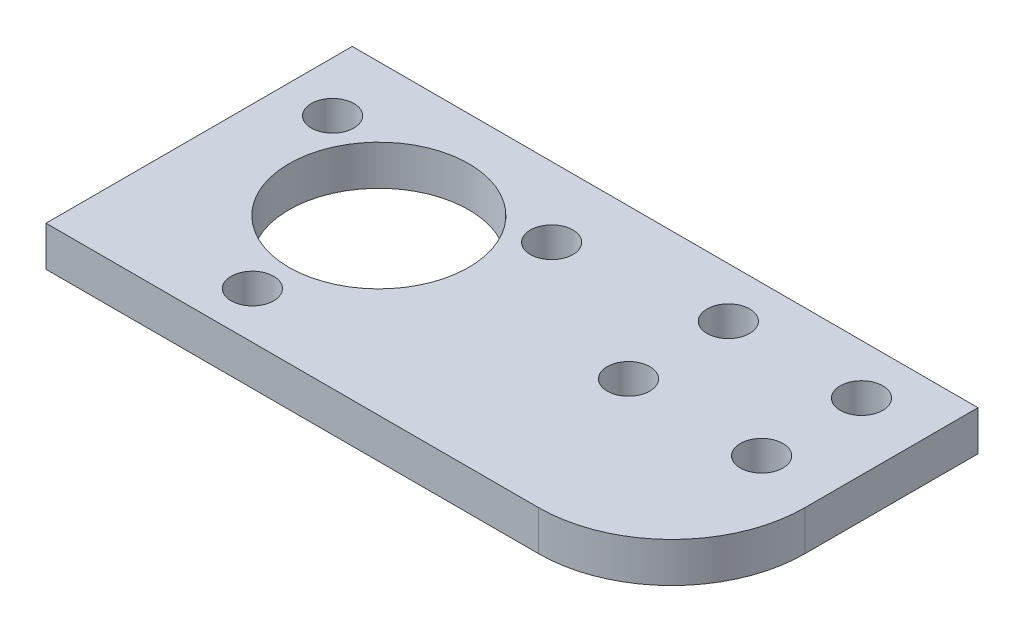
from build123d import *

# Parameters (mm, degrees)
SKETCH_1_W          = 55
SKETCH_1_H          = 20
EXTRUDE_1_DEPTH     = 3
SKETCH_2_R          = 1.6
SKETCH_2_R_2        = 6.75
CUT_EXTRUDE_1_DEPTH = 30.41513216
SKETCH_4_R          = 1.6
CUT_EXTRUDE_2_DEPTH = 30.41513216
EXTRUDE_2_DEPTH     = 3
SKETCH_6_R          = 1.6
CUT_EXTRUDE_3_DEPTH = 31.565503431
SKETCH_7_W          = 8
SKETCH_7_H          = 23
CUT_EXTRUDE_4_DEPTH = 31.565503431
FILLET_1_R          = 10


with BuildPart() as part:
    # 草图1 → 凸台-拉伸1 (new body)
    with BuildSketch(Plane(origin=(0, 0, 0), x_dir=(1, 0, 0), z_dir=(0, 1, 0))):
        Rectangle(SKETCH_1_W, SKETCH_1_H)
    extrude(amount=EXTRUDE_1_DEPTH)

    # 草图2 → 切除-拉伸1 (cut, through all)
    with BuildSketch(Plane(origin=(0, 3, 0), x_dir=(1, 0, 0), z_dir=(0, 1, 0))):
        with Locations(Location((-15.727241336, 4.75, 0), (0, 0, 270))):
            Circle(SKETCH_2_R)
        with Locations((-7.5, -9.5)):
            Circle(SKETCH_2_R)
        with Locations(Location((0.727241336, 4.75, 0), (0, 0, 270))):
            Circle(SKETCH_2_R)
        with Locations(Location((-7.5, 0, 0), (0, 0, 270))):
            Circle(SKETCH_2_R_2)
    extrude(amount=-CUT_EXTRUDE_1_DEPTH, mode=Mode.SUBTRACT)

    # 草图4 → 切除-拉伸2 (cut, through all)
    with BuildSketch(Plane(origin=(0, 3, 0), x_dir=(1, 0, 0), z_dir=(0, 1, 0))):
        with Locations(Location((22.5, 6.25, 0), (0, 0, 270))):
            Circle(SKETCH_4_R)
        with Locations(Location((12.5, 6.25, 0), (0, 0, 90))):
            Circle(SKETCH_4_R)
        with Locations(Location((22.5, -1.25, 0), (0, 0, 90))):
            Circle(SKETCH_4_R)
        with Locations(Location((12.5, -1.25, 0), (0, 0, 270))):
            Circle(SKETCH_4_R)
    extrude(amount=-CUT_EXTRUDE_2_DEPTH, mode=Mode.SUBTRACT)

    # 草图5 → 凸台-拉伸2 (add)
    with BuildSketch(Plane(origin=(0, 3, 0), x_dir=(1, 0, 0), z_dir=(0, 1, 0))):
        Polygon((-27.5, -10), (-27.5, -13), (0, -13), (27.5, -13), (27.5, -10), align=None)
    extrude(amount=-EXTRUDE_2_DEPTH)

    # 草图6 → 切除-拉伸3 (cut, through all)
    with BuildSketch(Plane(origin=(0, 3, 0), x_dir=(1, 0, 0), z_dir=(0, 1, 0))):
        with Locations(Location((-7.5, -9.5, 0), (0, 0, 270))):
            Circle(SKETCH_6_R)
    extrude(amount=-CUT_EXTRUDE_3_DEPTH, mode=Mode.SUBTRACT)

    # 草图7 → 切除-拉伸4 (cut, through all)
    with BuildSketch(Plane(origin=(0, 3, 0), x_dir=(1, 0, 0), z_dir=(0, 1, 0))):
        with Locations((-23.5, -1.5)):
            Rectangle(SKETCH_7_W, SKETCH_7_H)
    extrude(amount=-CUT_EXTRUDE_4_DEPTH, mode=Mode.SUBTRACT)

    # 圆角1
    fillet_1_edges = [part.edges().sort_by_distance(p)[0] for p in [
        (27.5, 1.5, 13),
    ]]
    fillet(fillet_1_edges, radius=FILLET_1_R)


solid = part.part
